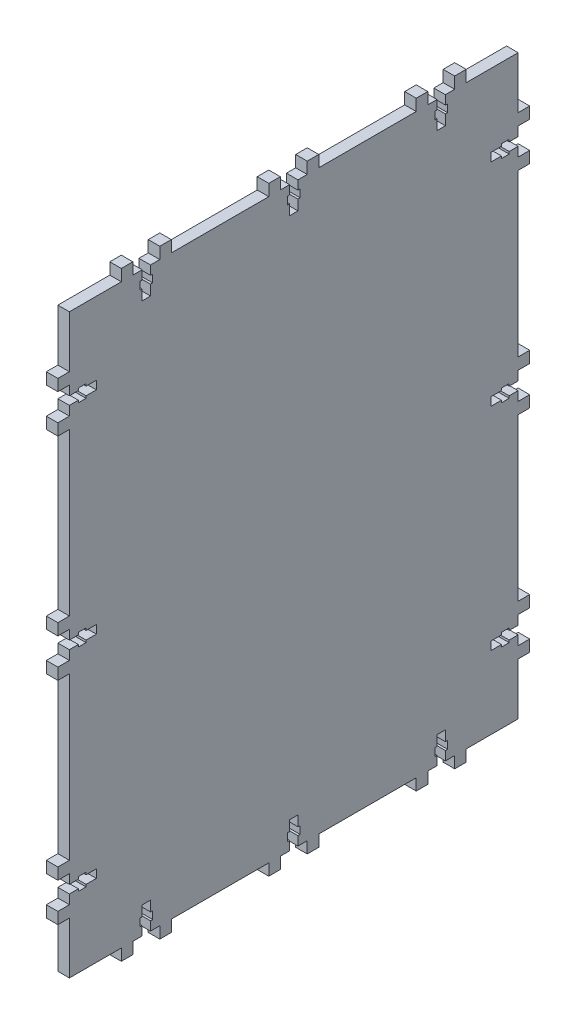
from build123d import *

# Parameters (mm, degrees)
BOSS_EXTRUDE1_DEPTH = 9


with BuildPart() as part:
    # Sketch1 → Boss-Extrude1 (new body)
    with BuildSketch(Plane(origin=(0, 0, 0), x_dir=(0, 0, -1), z_dir=(1, 0, 0))):
        Polygon((-175, -225), (-134.5, -225), (-134.5, -234), (-125.5, -234), (-125.5, -225), (-118.25, -225), (-118.25, -218), (-119.975, -218), (-119.975, -212), (-118.25, -212), (-118.25, -204), (-111.75, -204), (-111.75, -212), (-110.025, -212), (-110.025, -218), (-111.75, -218), (-111.75, -225), (-104.5, -225), (-104.5, -234), (-95.5, -234), (-95.5, -225), (-19.5, -225), (-19.5, -234), (-10.5, -234), (-10.5, -225), (-3.25, -225), (-3.25, -218), (-4.975, -218), (-4.975, -212), (-3.25, -212), (-3.25, -204), (3.25, -204), (3.25, -212), (4.975, -212), (4.975, -218), (3.25, -218), (3.25, -225), (10.5, -225), (10.5, -234), (19.5, -234), (19.5, -225), (95.5, -225), (95.5, -234), (104.5, -234), (104.5, -225), (111.75, -225), (111.75, -218), (110.025, -218), (110.025, -212), (111.75, -212), (111.75, -204), (118.25, -204), (118.25, -212), (119.975, -212), (119.975, -218), (118.25, -218), (118.25, -225), (125.5, -225), (125.5, -234), (134.5, -234), (134.5, -225), (175, -225), (175, -184.5), (184, -184.5), (184, -175.5), (175, -175.5), (175, -168.25), (168, -168.25), (168, -169.975), (162, -169.975), (162, -168.25), (154, -168.25), (154, -161.75), (162, -161.75), (162, -160.025), (168, -160.025), (168, -161.75), (175, -161.75), (175, -154.5), (184, -154.5), (184, -145.5), (175, -145.5), (175, -19.5), (184, -19.5), (184, -10.5), (175, -10.5), (175, -3.25), (168, -3.25), (168, -4.975), (162, -4.975), (162, -3.25), (154, -3.25), (154, 3.25), (162, 3.25), (162, 4.975), (168, 4.975), (168, 3.25), (175, 3.25), (175, 10.5), (184, 10.5), (184, 19.5), (175, 19.5), (175, 145.5), (184, 145.5), (184, 154.5), (175, 154.5), (175, 161.75), (168, 161.75), (168, 160.025), (162, 160.025), (162, 161.75), (154, 161.75), (154, 168.25), (162, 168.25), (162, 169.975), (168, 169.975), (168, 168.25), (175, 168.25), (175, 175.5), (184, 175.5), (184, 184.5), (175, 184.5), (175, 225), (134.5, 225), (134.5, 234), (125.5, 234), (125.5, 225), (118.25, 225), (118.25, 218), (119.975, 218), (119.975, 212), (118.25, 212), (118.25, 204), (111.75, 204), (111.75, 212), (110.025, 212), (110.025, 218), (111.75, 218), (111.75, 225), (104.5, 225), (104.5, 234), (95.5, 234), (95.5, 225), (19.5, 225), (19.5, 234), (10.5, 234), (10.5, 225), (3.25, 225), (3.25, 218), (4.975, 218), (4.975, 212), (3.25, 212), (3.25, 204), (-3.25, 204), (-3.25, 212), (-4.975, 212), (-4.975, 218), (-3.25, 218), (-3.25, 225), (-10.5, 225), (-10.5, 234), (-19.5, 234), (-19.5, 225), (-95.5, 225), (-95.5, 234), (-104.5, 234), (-104.5, 225), (-111.75, 225), (-111.75, 218), (-110.025, 218), (-110.025, 212), (-111.75, 212), (-111.75, 204), (-118.25, 204), (-118.25, 212), (-119.975, 212), (-119.975, 218), (-118.25, 218), (-118.25, 225), (-125.5, 225), (-125.5, 234), (-134.5, 234), (-134.5, 225), (-175, 225), (-175, 184.5), (-184, 184.5), (-184, 175.5), (-175, 175.5), (-175, 168.25), (-168, 168.25), (-168, 169.975), (-162, 169.975), (-162, 168.25), (-154, 168.25), (-154, 161.75), (-162, 161.75), (-162, 160.025), (-168, 160.025), (-168, 161.75), (-175, 161.75), (-175, 154.5), (-184, 154.5), (-184, 145.5), (-175, 145.5), (-175, 19.5), (-184, 19.5), (-184, 10.5), (-175, 10.5), (-175, 3.25), (-168, 3.25), (-168, 4.975), (-162, 4.975), (-162, 3.25), (-154, 3.25), (-154, -3.25), (-162, -3.25), (-162, -4.975), (-168, -4.975), (-168, -3.25), (-175, -3.25), (-175, -10.5), (-184, -10.5), (-184, -19.5), (-175, -19.5), (-175, -145.5), (-184, -145.5), (-184, -154.5), (-175, -154.5), (-175, -161.75), (-168, -161.75), (-168, -160.025), (-162, -160.025), (-162, -161.75), (-154, -161.75), (-154, -168.25), (-162, -168.25), (-162, -169.975), (-168, -169.975), (-168, -168.25), (-175, -168.25), (-175, -175.5), (-184, -175.5), (-184, -184.5), (-175, -184.5), align=None)
    extrude(amount=BOSS_EXTRUDE1_DEPTH)


solid = part.part
